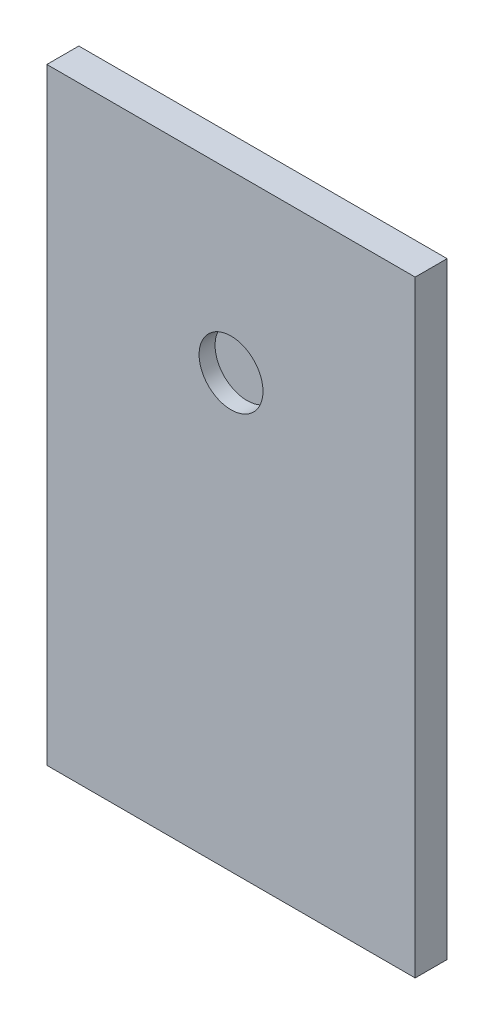
from build123d import *

# Parameters (mm, degrees)
SKETCH_1_W          = 57.64
SKETCH_1_H          = 125
EXTRUDE_1_DEPTH     = 5
CUT_EXTRUDE_1_DEPTH = 2.5
SKETCH_3_W          = 57.64
SKETCH_3_H          = 30
CUT_EXTRUDE_2_DEPTH = 10


with BuildPart() as part:
    # 스케치1 → 보스-돌출1 (new body)
    with BuildSketch(Plane.XY):
        Rectangle(SKETCH_1_W, SKETCH_1_H)
    extrude(amount=EXTRUDE_1_DEPTH)

    # 스케치2 → 컷-돌출1 (cut)
    with BuildSketch(Plane.XY.offset(5)):
        with BuildLine():
            ThreePointArc((-5, 5.10170356), (0, 10.10170356), (5, 5.10170356))
            ThreePointArc((5, 5.10170356), (0, 0.10170356), (-5, 5.10170356))
        make_face()
    extrude(amount=-CUT_EXTRUDE_1_DEPTH, mode=Mode.SUBTRACT)

    # 스케치3 → 컷-돌출2 (cut)
    with BuildSketch(Plane.XY.offset(5)):
        with Locations((0, 47.5)):
            Rectangle(SKETCH_3_W, SKETCH_3_H)
    extrude(amount=-CUT_EXTRUDE_2_DEPTH, mode=Mode.SUBTRACT)


solid = part.part
